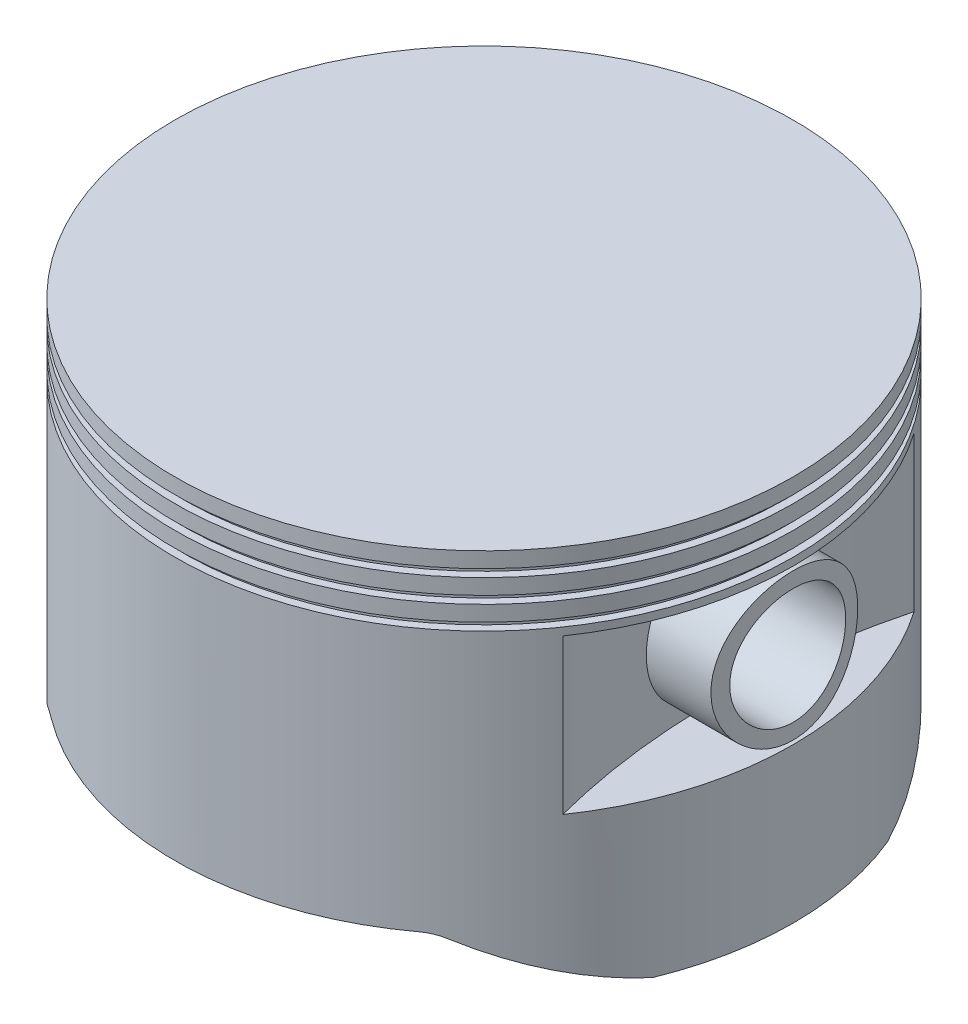
from build123d import *

# Parameters (mm, degrees)
SKETCH1_W                            = 40
SKETCH1_H                            = 50
CUT_EXTRUDE1_DEPTH                   = 55
SKETCH3_R                            = 90
CUT_EXTRUDE4_DEPTH                   = 20
BOSS_EXTRUDE1_REACH                  = 63.847
BOSS_EXTRUDE1_END_RADIUS             = 40
SKETCH4_R                            = 9.5
BOSS_EXTRUDE1_DIRECTION_2_REACH      = 63.847
BOSS_EXTRUDE1_DIRECTION_2_END_RADIUS = 40
SKETCH5_R                            = 7.5
CUT_EXTRUDE5_DEPTH                   = 55
SKETCH6_W                            = 1
SKETCH6_H                            = 1


with BuildPart() as part:
    # Sketch1 → Revolve1 (revolve)
    with BuildSketch(Plane.XY):
        with Locations((-20, 0)):
            Rectangle(SKETCH1_W, SKETCH1_H)
    revolve(axis=Axis((0, 25, 0), (0, -1, 0)))

    # Sketch2 → Cut-Extrude1 (cut, symmetric)
    with BuildSketch(Plane.XY):
        with BuildLine():
            Line((-37, -25), (-25.803847577, -18.535898385))
            ThreePointArc((-25.803847577, -18.535898385), (-24.839123758, -18.136296695), (-23.803847577, -18))
            Line((-23.803847577, -18), (23.803847577, -18))
            ThreePointArc((23.803847577, -18), (24.839123758, -18.136296695), (25.803847577, -18.535898385))
            Line((25.803847577, -18.535898385), (37, -25))
            Line((37, -25), (-37, -25))
        make_face()
    extrude(amount=CUT_EXTRUDE1_DEPTH, both=True, mode=Mode.SUBTRACT)

    # Sketch3 → Cut-Extrude4 (cut)
    with BuildSketch(Plane(origin=(0, -5, 0), x_dir=(-1, 0, 0), z_dir=(0, -1, 0))):
        with Locations((-120, 0)):
            Circle(SKETCH3_R)
        with Locations((120, 0)):
            Circle(SKETCH3_R)
    extrude(amount=-CUT_EXTRUDE4_DEPTH, mode=Mode.SUBTRACT)

    # Boss-Extrude1: up to this cylinder (the profile starts inside it)
    boss_extrude1_end = Plane(origin=(0, 5, 0), z_dir=(0, 1, 0)) * Cylinder(BOSS_EXTRUDE1_END_RADIUS, 208.694, mode=Mode.PRIVATE)
    # Sketch4 → Boss-Extrude1 (add, up to the surface)
    with BuildSketch(Plane(origin=(0, 0, 0), x_dir=(0, 0, -1), z_dir=(1, 0, 0)), mode=Mode.PRIVATE) as boss_extrude1_sk1:
        with Locations(Location((0, 5, 0), (0, 0, 180))):
            Circle(SKETCH4_R)
    boss_extrude1_tool1 = extrude(boss_extrude1_sk1.sketch, amount=BOSS_EXTRUDE1_REACH, mode=Mode.PRIVATE) & boss_extrude1_end
    add(boss_extrude1_tool1.solids().sort_by_distance((0, 5, 0))[0])

    # Boss-Extrude1 direction 2: up to this cylinder (the profile starts inside it)
    boss_extrude1_direction_2_end = Plane(origin=(0, 5, 0), z_dir=(0, 1, 0)) * Cylinder(BOSS_EXTRUDE1_DIRECTION_2_END_RADIUS, 208.694, mode=Mode.PRIVATE)
    # Sketch4 → Boss-Extrude1 direction 2 (add, up to the surface)
    with BuildSketch(Plane(origin=(0, 0, 0), x_dir=(0, 0, -1), z_dir=(1, 0, 0)), mode=Mode.PRIVATE) as boss_extrude1_direction_2_sk1:
        with Locations(Location((0, 5, 0), (0, 0, 180))):
            Circle(SKETCH4_R)
    boss_extrude1_direction_2_tool1 = extrude(boss_extrude1_direction_2_sk1.sketch, amount=-BOSS_EXTRUDE1_DIRECTION_2_REACH, mode=Mode.PRIVATE) & boss_extrude1_direction_2_end
    add(boss_extrude1_direction_2_tool1.solids().sort_by_distance((0, 5, 0))[0])

    # Sketch5 → Cut-Extrude5 (cut, symmetric)
    with BuildSketch(Plane(origin=(0, 0, 0), x_dir=(0, 0, -1), z_dir=(1, 0, 0))):
        with Locations((0, 5)):
            Circle(SKETCH5_R)
    extrude(amount=CUT_EXTRUDE5_DEPTH, both=True, mode=Mode.SUBTRACT)

    # Sketch6 → Cut-Revolve1 (revolve, cut)
    with BuildSketch(Plane.XY, mode=Mode.PRIVATE) as cut_revolve1_sk:
        with Locations((-39.5, 22.5)):
            Rectangle(SKETCH6_W, SKETCH6_H)
        with Locations((-39.5, 19.5)):
            Rectangle(SKETCH6_W, SKETCH6_H)
        with Locations((-39.5, 16.5)):
            Rectangle(SKETCH6_W, SKETCH6_H)
    revolve(cut_revolve1_sk.sketch.rotate(Axis((0, 0, 0), (0, 1, 0)), 180), axis=Axis((0, 0, 0), (0, 1, 0)), mode=Mode.SUBTRACT)


solid = part.part
